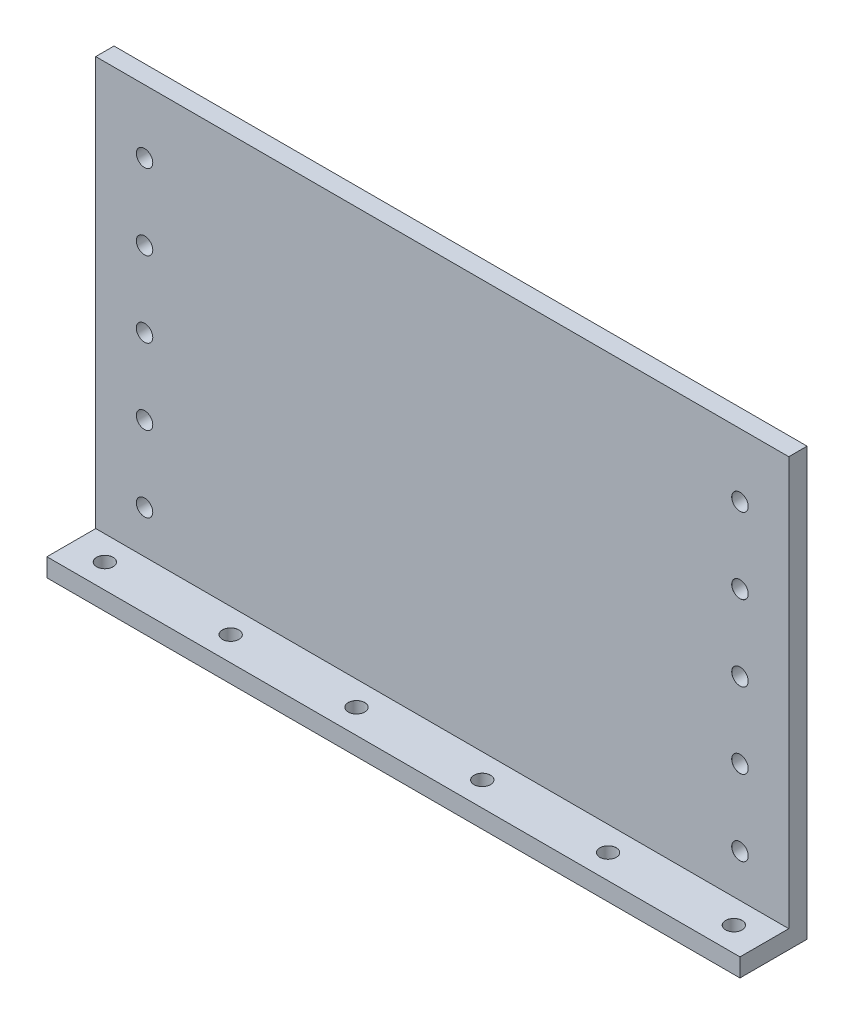
from build123d import *

# Parameters (mm, degrees)
SKETCH1_W                       = 568
SKETCH1_H                       = 350
BOSS_EXTRUDE1_DEPTH             = 15
SKETCH4_W                       = 568
SKETCH4_H                       = 15
BOSS_EXTRUDE3_DEPTH             = 40
M12_CLEARANCE_HOLE2_D           = 13.5
M12_CLEARANCE_HOLE2_CSINK_D     = 13.55
M12_CLEARANCE_HOLE2_CSINK_ANGLE = 100
LPATTERN1_COUNT                 = 5
LPATTERN1_PITCH                 = 62
M12_CLEARANCE_HOLE3_D           = 13.5
M12_CLEARANCE_HOLE3_CSINK_D     = 13.55
M12_CLEARANCE_HOLE3_CSINK_ANGLE = 100
LPATTERN2_COUNT                 = 5
LPATTERN2_PITCH                 = 62
M12_CLEARANCE_HOLE4_D           = 13.5
M12_CLEARANCE_HOLE4_CSINK_D     = 13.55
M12_CLEARANCE_HOLE4_CSINK_ANGLE = 100
LPATTERN3_COUNT                 = 6
LPATTERN3_PITCH                 = 103.1


with BuildPart() as part:
    # Sketch1 → Boss-Extrude1 (new body)
    with BuildSketch(Plane.XY):
        Rectangle(SKETCH1_W, SKETCH1_H)
    extrude(amount=BOSS_EXTRUDE1_DEPTH)

    # Sketch4 → Boss-Extrude3 (add)
    with BuildSketch(Plane.XY.offset(15)):
        with Locations((0, -167.5)):
            Rectangle(SKETCH4_W, SKETCH4_H)
    extrude(amount=BOSS_EXTRUDE3_DEPTH)

    # M12 Clearance Hole2 (through all)
    with Locations(Plane.XY.offset(15)):
        with Locations((244, 123)):
            m12_clearance_hole2 = CounterSinkHole(M12_CLEARANCE_HOLE2_D / 2, M12_CLEARANCE_HOLE2_CSINK_D / 2, counter_sink_angle=M12_CLEARANCE_HOLE2_CSINK_ANGLE)

    # LPattern1: M12 Clearance Hole2 ×5
    with Locations(*[(0, -i * LPATTERN1_PITCH, 0) for i in range(1, LPATTERN1_COUNT)]):
        add(m12_clearance_hole2, mode=Mode.SUBTRACT)

    # M12 Clearance Hole3 (through all)
    with Locations(Plane(origin=(0, 0, 0), x_dir=(1, 0, 0), z_dir=(0, 0, -1))):
        with Locations((-244, -123)):
            m12_clearance_hole3 = CounterSinkHole(M12_CLEARANCE_HOLE3_D / 2, M12_CLEARANCE_HOLE3_CSINK_D / 2, counter_sink_angle=M12_CLEARANCE_HOLE3_CSINK_ANGLE)

    # LPattern2: M12 Clearance Hole3 ×5
    with Locations(*[(0, -i * LPATTERN2_PITCH, 0) for i in range(1, LPATTERN2_COUNT)]):
        add(m12_clearance_hole3, mode=Mode.SUBTRACT)

    # M12 Clearance Hole4 (through all)
    with Locations(Plane(origin=(0, -160, 0), x_dir=(1, 0, 0), z_dir=(0, 1, 0))):
        with Locations((259, -35)):
            m12_clearance_hole4 = CounterSinkHole(M12_CLEARANCE_HOLE4_D / 2, M12_CLEARANCE_HOLE4_CSINK_D / 2, counter_sink_angle=M12_CLEARANCE_HOLE4_CSINK_ANGLE)

    # LPattern3: M12 Clearance Hole4 ×6
    with Locations(*[(-i * LPATTERN3_PITCH, 0, 0) for i in range(1, LPATTERN3_COUNT)]):
        add(m12_clearance_hole4, mode=Mode.SUBTRACT)


solid = part.part
